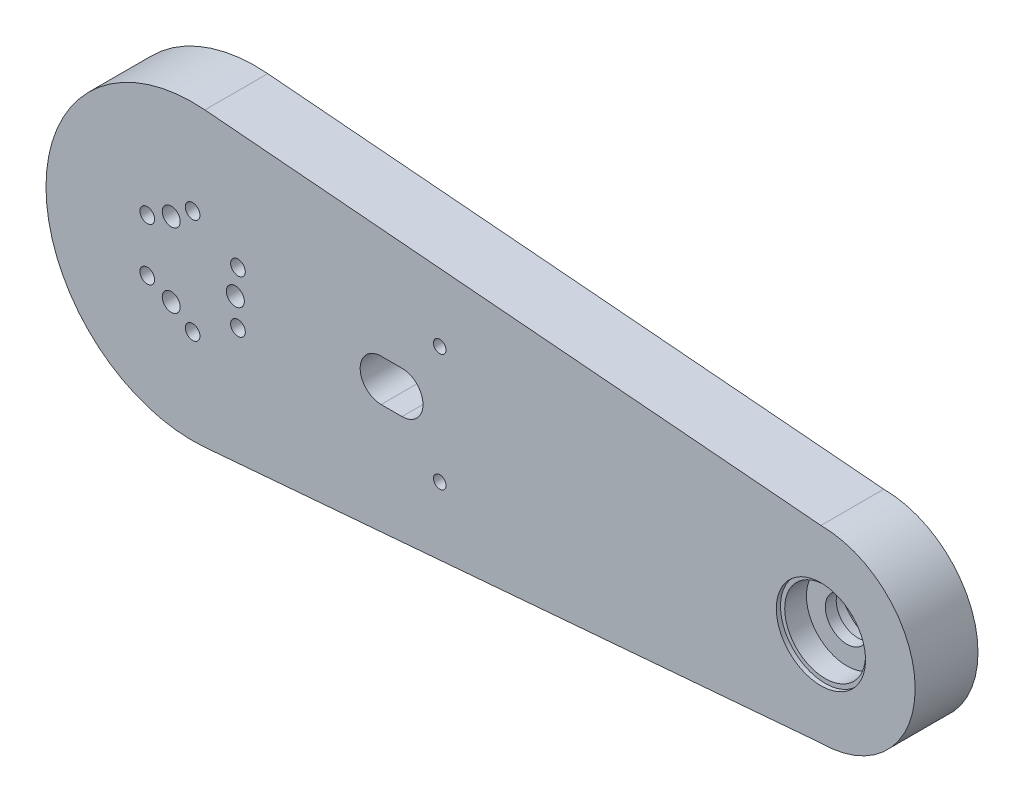
from build123d import *

# Parameters (mm, degrees)
EXTRUDE_1_DEPTH           = 15
CUT_EXTRUDE_1_DEPTH       = 177.652908269
HOLE_WIZARD_1_D           = 4.3
HOLE_WIZARD_2_D           = 4.3
HOLE_WIZARD_3_D           = 4.3
HOLE_WIZARD_4_D           = 3.5
HOLE_WIZARD_4_CBORE_D     = 6.5
HOLE_WIZARD_4_CBORE_DEPTH = 1
HOLE_WIZARD_5_D           = 3.5
HOLE_WIZARD_5_CBORE_D     = 6.5
HOLE_WIZARD_5_CBORE_DEPTH = 1
HOLE_WIZARD_6_D           = 3.5
HOLE_WIZARD_6_CBORE_D     = 6.5
HOLE_WIZARD_6_CBORE_DEPTH = 1
HOLE_WIZARD_7_D           = 3.5
HOLE_WIZARD_7_CBORE_D     = 6.5
HOLE_WIZARD_7_CBORE_DEPTH = 1
HOLE_WIZARD_8_D           = 3.5
HOLE_WIZARD_8_CBORE_D     = 6.5
HOLE_WIZARD_8_CBORE_DEPTH = 1
HOLE_WIZARD_9_D           = 3.5
HOLE_WIZARD_9_CBORE_D     = 6.5
HOLE_WIZARD_9_CBORE_DEPTH = 1
HOLE_WIZARD_10_D          = 3
HOLE_WIZARD_11_D          = 3


with BuildPart() as part:
    # 草图2 → 凸台-拉伸1 (new body)
    with BuildSketch(Plane.XY.offset(15)):
        with BuildLine():
            Line((150, 22.5), (2.93516031, 34.876709047))
            ThreePointArc((2.93516031, 34.876709047), (-35, 0), (2.93516031, -34.876709047))
            Line((2.93516031, -34.876709047), (150, -22.5))
            ThreePointArc((150, -22.5), (172.5, 0), (150, 22.5))
        make_face()
    extrude(amount=-EXTRUDE_1_DEPTH)

    # 草图3 → 切除-拉伸1 (cut, through all)
    with BuildSketch(Plane(origin=(0, 0, 0), x_dir=(-1, 0, 0), z_dir=(0, 0, -1))):
        with BuildLine():
            Line((-45, 5), (-50, 5))
            ThreePointArc((-50, 5), (-55, 0), (-50, -5))
            Line((-50, -5), (-45, -5))
            ThreePointArc((-45, -5), (-40, 0), (-45, 5))
        make_face()
    extrude(amount=-CUT_EXTRUDE_1_DEPTH, mode=Mode.SUBTRACT)

    # 草图4 → 切除-旋转1 (revolve, cut)
    with BuildSketch(Plane.XZ, mode=Mode.PRIVATE) as cut_revolve_1_sk:
        Polygon((160.65, 15), (150, 15), (150, 0), (160.65, 0), (160.65, 1), (159.65, 1), (159.65, 6.2), (155.15, 6.2), (155.15, 8.8), (159.65, 8.8), (159.65, 14), (160.65, 14), align=None)
    revolve(cut_revolve_1_sk.sketch.rotate(Axis((150, 0, 15), (0, 0, -1)), 180), axis=Axis((150, 0, 15), (0, 0, -1)), mode=Mode.SUBTRACT)

    # 孔1 (through all)
    with Locations(Plane(origin=(0, 0, 0), x_dir=(-1, 0, 0), z_dir=(0, 0, -1))):
        with Locations((5.1, 8.833459119)):
            Hole(HOLE_WIZARD_1_D / 2)

    # 孔2 (through all)
    with Locations(Plane(origin=(0, 0, 0), x_dir=(-1, 0, 0), z_dir=(0, 0, -1))):
        with Locations((5.1, -8.833459119)):
            Hole(HOLE_WIZARD_2_D / 2)

    # 孔3 (through all)
    with Locations(Plane(origin=(0, 0, 0), x_dir=(-1, 0, 0), z_dir=(0, 0, -1))):
        with Locations((-10.2, 0)):
            Hole(HOLE_WIZARD_3_D / 2)

    # 孔4 (through all)
    with Locations(Plane(origin=(0, 0, 0), x_dir=(-1, 0, 0), z_dir=(0, 0, -1))):
        with Locations((10.825317547, 6.25)):
            CounterBoreHole(HOLE_WIZARD_4_D / 2, HOLE_WIZARD_4_CBORE_D / 2, HOLE_WIZARD_4_CBORE_DEPTH)

    # 孔5 (through all)
    with Locations(Plane(origin=(0, 0, 0), x_dir=(-1, 0, 0), z_dir=(0, 0, -1))):
        with Locations((0, 12.5)):
            CounterBoreHole(HOLE_WIZARD_5_D / 2, HOLE_WIZARD_5_CBORE_D / 2, HOLE_WIZARD_5_CBORE_DEPTH)

    # 孔6 (through all)
    with Locations(Plane(origin=(0, 0, 0), x_dir=(-1, 0, 0), z_dir=(0, 0, -1))):
        with Locations((-10.825317547, 6.25)):
            CounterBoreHole(HOLE_WIZARD_6_D / 2, HOLE_WIZARD_6_CBORE_D / 2, HOLE_WIZARD_6_CBORE_DEPTH)

    # 孔7 (through all)
    with Locations(Plane(origin=(0, 0, 0), x_dir=(-1, 0, 0), z_dir=(0, 0, -1))):
        with Locations((-10.825317547, -6.25)):
            CounterBoreHole(HOLE_WIZARD_7_D / 2, HOLE_WIZARD_7_CBORE_D / 2, HOLE_WIZARD_7_CBORE_DEPTH)

    # 孔8 (through all)
    with Locations(Plane(origin=(0, 0, 0), x_dir=(-1, 0, 0), z_dir=(0, 0, -1))):
        with Locations((0, -12.5)):
            CounterBoreHole(HOLE_WIZARD_8_D / 2, HOLE_WIZARD_8_CBORE_D / 2, HOLE_WIZARD_8_CBORE_DEPTH)

    # 孔9 (through all)
    with Locations(Plane(origin=(0, 0, 0), x_dir=(-1, 0, 0), z_dir=(0, 0, -1))):
        with Locations((10.825317547, -6.25)):
            CounterBoreHole(HOLE_WIZARD_9_D / 2, HOLE_WIZARD_9_CBORE_D / 2, HOLE_WIZARD_9_CBORE_DEPTH)

    # 孔10 (through all)
    with Locations(Plane(origin=(0, 0, 0), x_dir=(-1, 0, 0), z_dir=(0, 0, -1))):
        with Locations((-59, -14)):
            Hole(HOLE_WIZARD_10_D / 2)

    # 孔11 (through all)
    with Locations(Plane(origin=(0, 0, 0), x_dir=(-1, 0, 0), z_dir=(0, 0, -1))):
        with Locations((-59, 14)):
            Hole(HOLE_WIZARD_11_D / 2)


solid = part.part
